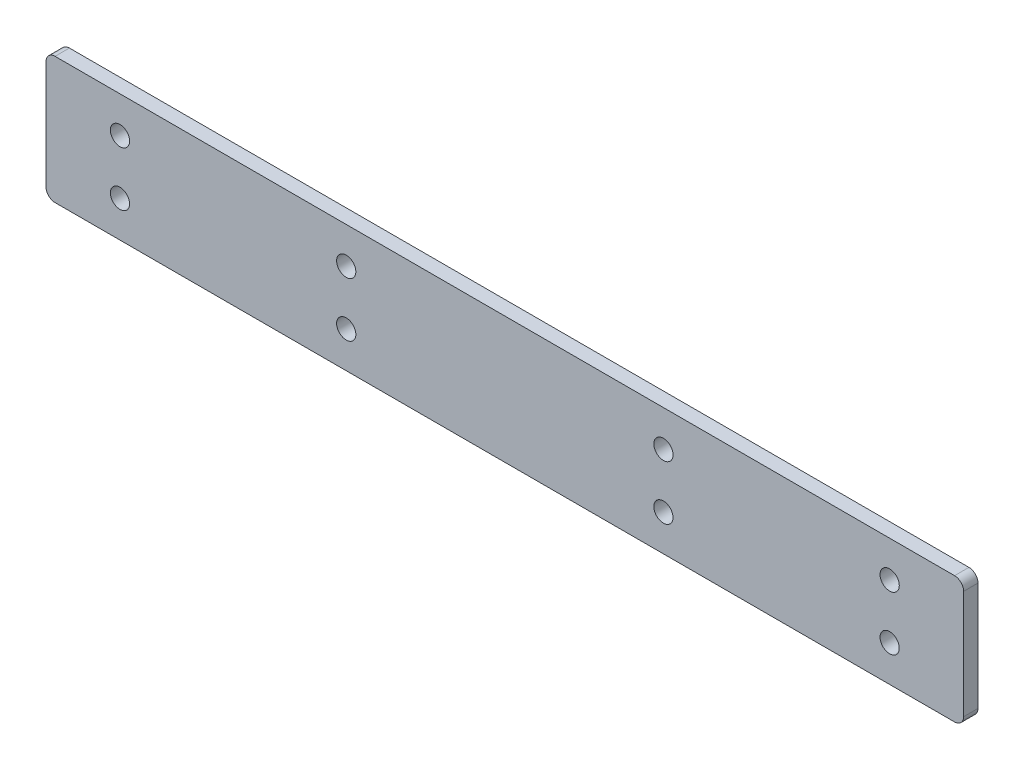
from build123d import *

# Parameters (mm, degrees)
SKETCH1_W           = 202.8
SKETCH1_H           = 28
SKETCH1_R           = 2.125
BOSS_EXTRUDE1_DEPTH = 3.175
FILLET1_R           = 2


with BuildPart() as part:
    # Sketch1 → Boss-Extrude1 (new body)
    with BuildSketch(Plane.XY):
        Rectangle(SKETCH1_W, SKETCH1_H)
        with Locations((85.05, 6)):
            Circle(SKETCH1_R, mode=Mode.SUBTRACT)
        with Locations(Location((85.05, -6, 0), (0, 0, 180))):
            Circle(SKETCH1_R, mode=Mode.SUBTRACT)
        with Locations((-85.05, -6)):
            Circle(SKETCH1_R, mode=Mode.SUBTRACT)
        with Locations(Location((-85.05, 6, 0), (0, 0, 180))):
            Circle(SKETCH1_R, mode=Mode.SUBTRACT)
        with Locations((-35.05, 6)):
            Circle(SKETCH1_R, mode=Mode.SUBTRACT)
        with Locations(Location((-35.05, -6, 0), (0, 0, 180))):
            Circle(SKETCH1_R, mode=Mode.SUBTRACT)
        with Locations((35.05, -6)):
            Circle(SKETCH1_R, mode=Mode.SUBTRACT)
        with Locations(Location((35.05, 6, 0), (0, 0, 180))):
            Circle(SKETCH1_R, mode=Mode.SUBTRACT)
    extrude(amount=BOSS_EXTRUDE1_DEPTH)

    # Fillet1
    fillet1_edges = [part.edges().sort_by_distance(p)[0] for p in [
        (101.4, -14, 1.5875),
        (-101.4, -14, 1.5875),
        (-101.4, 14, 1.5875),
        (101.4, 14, 1.5875),
    ]]
    fillet(fillet1_edges, radius=FILLET1_R)


solid = part.part
